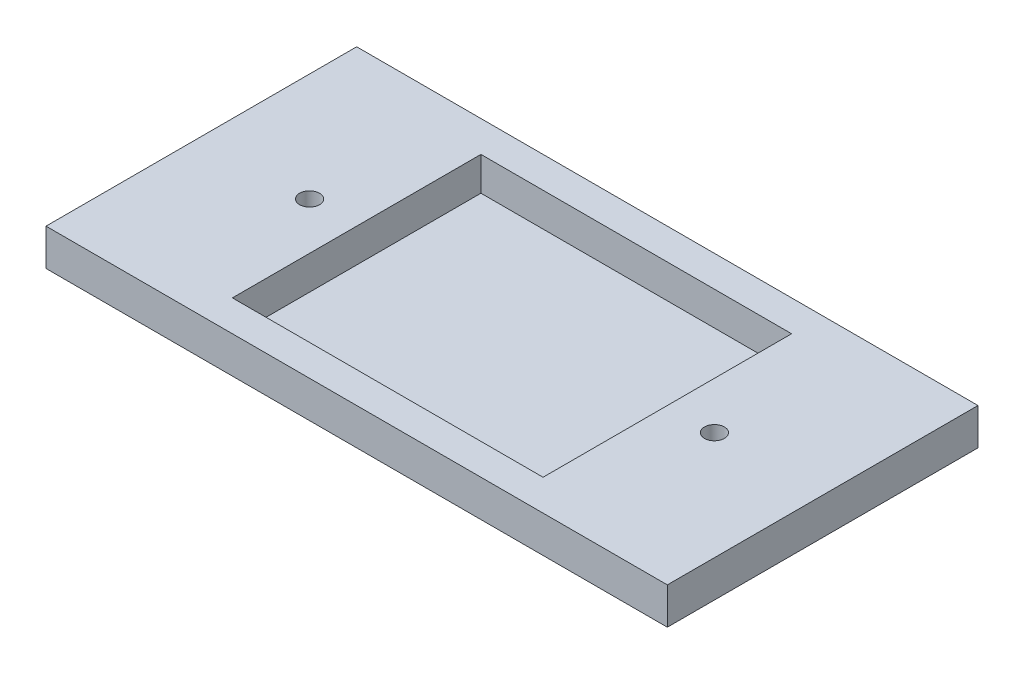
from build123d import *

# Parameters (mm, degrees)
SKETCH1_W           = 101.6
SKETCH1_H           = 50.8
BOSS_EXTRUDE1_DEPTH = 6
SKETCH2_W           = 50.8
SKETCH2_H           = 40.64
CUT_EXTRUDE1_DEPTH  = 5.5
SKETCH3_R           = 1.63195
CUT_EXTRUDE2_DEPTH  = 58.112170332
SKETCH4_R           = 1.63195
CUT_EXTRUDE3_DEPTH  = 58.112170332


with BuildPart() as part:
    # Sketch1 → Boss-Extrude1 (new body)
    with BuildSketch(Plane(origin=(0, 0, 0), x_dir=(1, 0, 0), z_dir=(0, 1, 0))):
        Rectangle(SKETCH1_W, SKETCH1_H)
    extrude(amount=BOSS_EXTRUDE1_DEPTH)

    # Sketch2 → Cut-Extrude1 (cut)
    with BuildSketch(Plane(origin=(0, 6, 0), x_dir=(1, 0, 0), z_dir=(0, 1, 0))):
        Rectangle(SKETCH2_W, SKETCH2_H)
    extrude(amount=-CUT_EXTRUDE1_DEPTH, mode=Mode.SUBTRACT)

    # Sketch3 → Cut-Extrude2 (cut, through all)
    with BuildSketch(Plane(origin=(0, 6, 0), x_dir=(1, 0, 0), z_dir=(0, 1, 0))):
        with Locations(Location((-33.1, 0, 0), (0, 0, 270))):
            Circle(SKETCH3_R)
    extrude(amount=-CUT_EXTRUDE2_DEPTH, mode=Mode.SUBTRACT)

    # Sketch4 → Cut-Extrude3 (cut, through all)
    with BuildSketch(Plane(origin=(0, 6, 0), x_dir=(1, 0, 0), z_dir=(0, 1, 0))):
        with Locations(Location((33.1, 0, 0), (0, 0, 270))):
            Circle(SKETCH4_R)
    extrude(amount=-CUT_EXTRUDE3_DEPTH, mode=Mode.SUBTRACT)


solid = part.part
